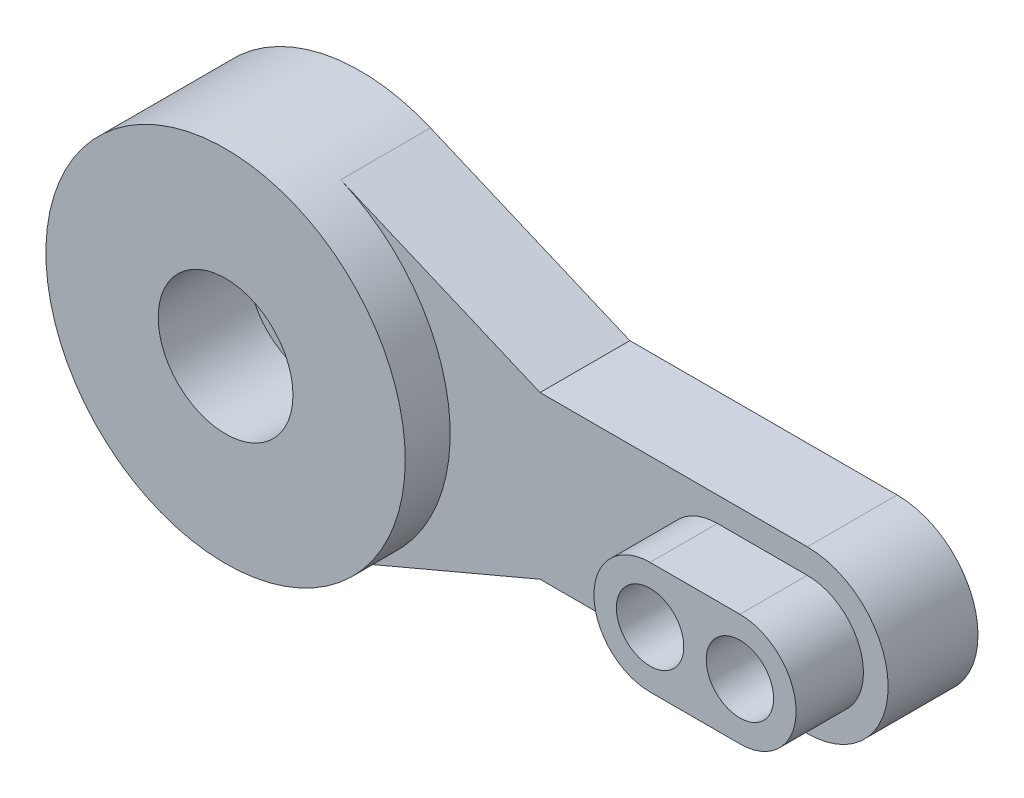
from build123d import *
from build123d.topology import SkipClean

# Parameters (mm, degrees)
BOSS_EXTRUDE1_DEPTH      = 4
SKETCH4_R                = 8
BOSS_EXTRUDE2_DEPTH      = 2
BOSS_EXTRUDE3_DEPTH      = 3
F_3_0_3_DIAMETER_HOLE1_D = 3
F_6_0_6_DIAMETER_HOLE1_D = 6
BOSS_EXTRUDE4_START      = 2
SKETCH12_R               = 3
SKETCH12_R_2             = 2
BOSS_EXTRUDE4_DEPTH      = 2


with BuildPart() as part:
    # Sketch1 → Boss-Extrude1 (new body)
    with BuildSketch(Plane.XY):
        with BuildLine():
            Line((3.123869731, 7.364878676), (12, 3.6))
            Line((12, 3.6), (23.9, 3.6))
            ThreePointArc((23.9, 3.6), (27.5, 0), (23.9, -3.6))
            Line((23.9, -3.6), (12, -3.6))
            Line((12, -3.6), (3.123869731, -7.364878676))
            ThreePointArc((3.123869731, -7.364878676), (-8, 0), (3.123869731, 7.364878676))
        make_face()
    extrude(amount=BOSS_EXTRUDE1_DEPTH)

    # Sketch4 → Boss-Extrude2 (add)
    with SkipClean():  # the faces are left unmerged after this step: merging them gives an invalid solid
        with BuildSketch(Plane.XY.offset(4)):
            with Locations(Location((0, 0, 0), (0, 0, 67.015399011))):
                Circle(SKETCH4_R)
        extrude(amount=BOSS_EXTRUDE2_DEPTH)

    # Sketch5 → Boss-Extrude3 (add)
    with SkipClean():  # the faces are left unmerged after this step: merging them gives an invalid solid
        with BuildSketch(Plane.XY.offset(4)):
            with BuildLine():
                Line((23.9, -2.5), (19.9, -2.5))
                ThreePointArc((19.9, -2.5), (17.4, 0), (19.9, 2.5))
                Line((19.9, 2.5), (23.9, 2.5))
                ThreePointArc((23.9, 2.5), (26.4, 0), (23.9, -2.5))
            make_face()
        extrude(amount=BOSS_EXTRUDE3_DEPTH)

    # Ø3.0 (3) Diameter Hole1 (through all)
    with Locations(Plane(origin=(0, 0, 0), x_dir=(-1, 0, 0), z_dir=(0, 0, -1))):
        with Locations((-23.9, 0), (-19.9, 0)):
            Hole(F_3_0_3_DIAMETER_HOLE1_D / 2)

    # Ø6.0 (6) Diameter Hole1 (through all)
    with Locations(Plane(origin=(0, 0, 0), x_dir=(-1, 0, 0), z_dir=(0, 0, -1))):
        with Locations((0, 0)):
            Hole(F_6_0_6_DIAMETER_HOLE1_D / 2)

    # Sketch12 → Boss-Extrude4 (add)
    with SkipClean():  # the faces are left unmerged after this step: merging them gives an invalid solid
        with BuildSketch(Plane.XY.offset(BOSS_EXTRUDE4_START)):
            Circle(SKETCH12_R)
            with Locations(Location((0, 0, 0), (0, 0, 180))):
                Circle(SKETCH12_R_2, mode=Mode.SUBTRACT)
        extrude(amount=-BOSS_EXTRUDE4_DEPTH)


solid = part.part
